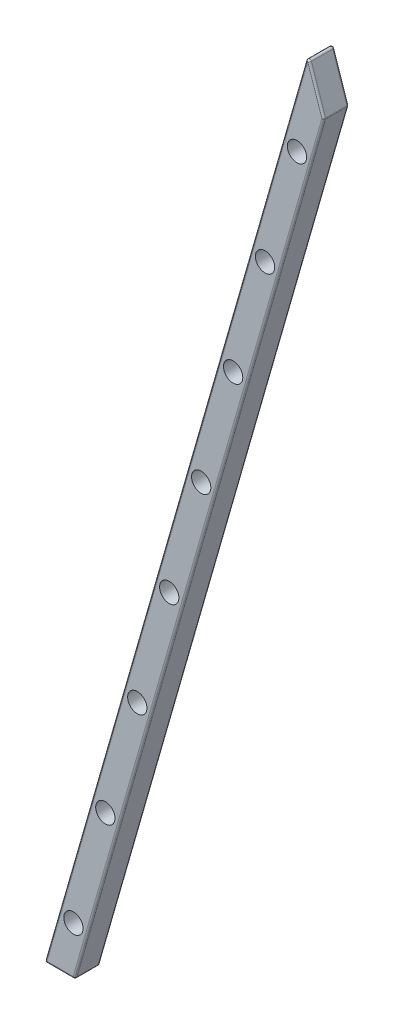
from build123d import *

# Parameters (mm, degrees)
BOSS_EXTRUDE1_DEPTH     = 6.5
CUT_EXTRUDE1_DEPTH      = 493.386170136
CUT_EXTRUDE1_DEPTH_BACK = 493.386170136
SKETCH2_R               = 5
FILLET1_R               = 1


with BuildPart() as part:
    # Sketch1 → Boss-Extrude1 (new, symmetric)
    with BuildSketch(Plane.XY):
        Polygon((0, 0), (129.035423591, 450), (120.599566698, 475), (-15.604491538, 0), align=None)
    extrude(amount=BOSS_EXTRUDE1_DEPTH, both=True)

    # Sketch2 → Cut-Extrude1 (cut, two sides: drawn at the far end of the back side and taken through both)
    with BuildSketch(Plane.XY.offset(6.5).offset(-CUT_EXTRUDE1_DEPTH_BACK)):
        with Locations((-0.633611125, 25)):
            Circle(SKETCH2_R)
        with Locations((15.904630224, 82.675701756)):
            Circle(SKETCH2_R)
        with Locations((32.442871573, 140.351403513)):
            Circle(SKETCH2_R)
        with Locations((48.981112922, 198.027105269)):
            Circle(SKETCH2_R)
        with Locations((65.519354271, 255.702807025)):
            Circle(SKETCH2_R)
        with Locations((82.05759562, 313.378508781)):
            Circle(SKETCH2_R)
        with Locations((98.595836969, 371.054210538)):
            Circle(SKETCH2_R)
        with Locations((115.134078318, 428.729912294)):
            Circle(SKETCH2_R)
    extrude(amount=CUT_EXTRUDE1_DEPTH + CUT_EXTRUDE1_DEPTH_BACK, mode=Mode.SUBTRACT)

    # Fillet1
    fillet1_edges = [part.edges().sort_by_distance(p)[0] for p in [
        (124.817495144, 462.5, 6.5),
        (52.49753758, 237.5, 6.5),
        (-7.802245769, 0, 6.5),
        (52.49753758, 237.5, -6.5),
        (124.817495144, 462.5, -6.5),
        (64.517711796, 225, -6.5),
        (-7.802245769, 0, -6.5),
        (-15.604491538, 0, 0),
        (120.599566698, 475, 0),
        (129.035423591, 450, 0),
        (0, 0, 0),
        (64.517711796, 225, 6.5),
    ]]
    fillet(fillet1_edges, radius=FILLET1_R)


solid = part.part
